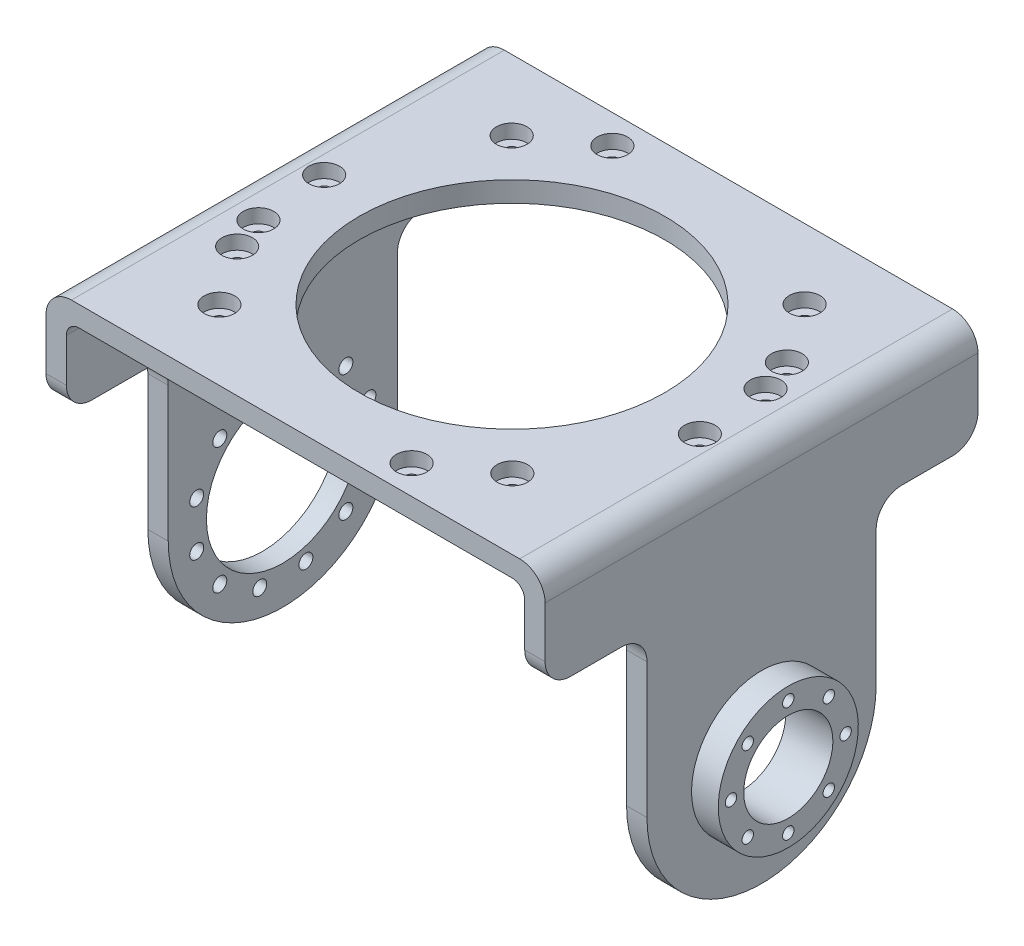
from build123d import *

# Parameters (mm, degrees)
EXTRUDE_1_DEPTH          = 170
SKETCH_2_R               = 60
CUT_EXTRUDE_1_DEPTH      = 180
CUT_EXTRUDE_2_DEPTH      = 313.955268369
CUT_EXTRUDE_2_DEPTH_BACK = 313.955268369
SKETCH_3_R               = 17.5
FILLET_1_R               = 70
FILLET_2_R               = 5
FILLET_3_R               = 10
SKETCH_6_R               = 30
CUT_EXTRUDE_6_DEPTH      = 39
SKETCH_10_R              = 2.5
CUT_EXTRUDE_10_DEPTH     = 10
CUT_EXTRUDE_START        = -5.5
SKETCH_11_R              = 6
SKETCH_11_R_2            = 2.5
CUT_EXTRUDE_11_DEPTH     = 5.5
SKETCH_12_R              = 2.75
CUT_EXTRUDE_12_DEPTH     = 10
EXTRUDE_START            = 10.5
SKETCH_14_R              = 27.5
SKETCH_14_R_2            = 17.5
EXTRUDE_2_DEPTH          = 10.5
SKETCH_13_R              = 2.25
CUT_EXTRUDE_13_DEPTH     = 15
CUT_EXTRUDE_START_2      = -262
CUT_EXTRUDE_14_DEPTH     = 262
FILLET_4_R               = 10


with BuildPart() as part:
    # 草图1 → 凸台-拉伸1 (new body)
    with BuildSketch(Plane.XY):
        Polygon((-180, 0), (0, 0), (0, -175), (8, -175), (8, 8), (-180, 8), (-188, 8), (-188, -175), (-180, -175), align=None)
    extrude(amount=EXTRUDE_1_DEPTH)

    # 草图2 → 切除-拉伸1 (cut)
    with BuildSketch(Plane(origin=(0, 8, 0), x_dir=(1, 0, 0), z_dir=(0, 1, 0))):
        with Locations(Location((-90, -85, 0), (0, 0, 180))):
            Circle(SKETCH_2_R)
    extrude(amount=-CUT_EXTRUDE_1_DEPTH, mode=Mode.SUBTRACT)

    # 草图3 → 切除-拉伸2 (cut, two sides: drawn at the far end of the back side and taken through both)
    with BuildSketch(Plane(origin=(8, 0, 0), x_dir=(0, 0, -1), z_dir=(1, 0, 0)).offset(-CUT_EXTRUDE_2_DEPTH_BACK)):
        with Locations(Location((-85, -95, 0), (0, 0, 90))):
            Circle(SKETCH_3_R)
    extrude(amount=CUT_EXTRUDE_2_DEPTH + CUT_EXTRUDE_2_DEPTH_BACK, mode=Mode.SUBTRACT)

    # 圆角1
    fillet_1_edges = [part.edges().sort_by_distance(p)[0] for p in [
        (4, -175, 0),
        (4, -175, 170),
        (-184, -175, 170),
        (-184, -175, 0),
    ]]
    fillet(fillet_1_edges, radius=FILLET_1_R)

    # 圆角2
    fillet_2_edges = [part.edges().sort_by_distance(p)[0] for p in [
        (0, 0, 85),
        (-180, 0, 85),
    ]]
    fillet(fillet_2_edges, radius=FILLET_2_R)

    # 圆角3
    fillet_3_edges = [part.edges().sort_by_distance(p)[0] for p in [
        (-188, 8, 85),
        (8, 8, 85),
    ]]
    fillet(fillet_3_edges, radius=FILLET_3_R)

    # 草图6 → 切除-拉伸6 (cut)
    with BuildSketch(Plane.ZY.offset(188)):
        with Locations(Location((85, -95, 0), (0, 0, 270))):
            Circle(SKETCH_6_R)
    extrude(amount=-CUT_EXTRUDE_6_DEPTH, mode=Mode.SUBTRACT)

    # 草图10 → 切除-拉伸10 (cut)
    with BuildSketch(Plane.XZ):
        with Locations(Location((-55.742253069, 158.674753309, 0), (0, 0, 270))):
            Circle(SKETCH_10_R)
        with Locations(Location((-32.485217492, 142.390001682, 0), (0, 0, 270))):
            Circle(SKETCH_10_R)
        with Locations(Location((-9.066918551, 92.169297536, 0), (0, 0, 270))):
            Circle(SKETCH_10_R)
        with Locations(Location((-11.541409366, 63.885738097, 0), (0, 0, 270))):
            Circle(SKETCH_10_R)
        with Locations(Location((-16.325246691, 50.742253069, 0), (0, 0, 270))):
            Circle(SKETCH_10_R)
        with Locations(Location((-32.609998318, 27.485217492, 0), (0, 0, 270))):
            Circle(SKETCH_10_R)
        with Locations(Location((-124.257746931, 11.325246691, 0), (0, 0, 270))):
            Circle(SKETCH_10_R)
        with Locations(Location((-147.514782508, 27.609998318, 0), (0, 0, 270))):
            Circle(SKETCH_10_R)
        with Locations(Location((-170.933081449, 77.830702464, 0), (0, 0, 270))):
            Circle(SKETCH_10_R)
        with Locations(Location((-168.458590634, 106.114261903, 0), (0, 0, 270))):
            Circle(SKETCH_10_R)
        with Locations(Location((-163.674753309, 119.257746931, 0), (0, 0, 270))):
            Circle(SKETCH_10_R)
        with Locations(Location((-147.390001682, 142.514782508, 0), (0, 0, 270))):
            Circle(SKETCH_10_R)
    extrude(amount=-CUT_EXTRUDE_10_DEPTH, mode=Mode.SUBTRACT)

    # 草图11 → 切除-拉伸11 (cut)
    # profile 1 of 12: a face of its own
    with BuildSketch(Plane(origin=(0, 8, 0), x_dir=(1, 0, 0), z_dir=(0, 1, 0)).offset(CUT_EXTRUDE_START)):
        with Locations(Location((-32.485217492, -142.390001682, 0), (0, 0, 180))):
            Circle(SKETCH_11_R)
        with Locations(Location((-32.485217492, -142.390001682, 0), (0, 0, 90))):
            Circle(SKETCH_11_R_2, mode=Mode.SUBTRACT)
    # profile 2 of 12: a face of its own
    with BuildSketch(Plane(origin=(0, 8, 0), x_dir=(1, 0, 0), z_dir=(0, 1, 0)).offset(CUT_EXTRUDE_START)):
        with Locations(Location((-55.742253069, -158.674753309, 0), (0, 0, 180))):
            Circle(SKETCH_11_R)
        with Locations(Location((-55.742253069, -158.674753309, 0), (0, 0, 90))):
            Circle(SKETCH_11_R_2, mode=Mode.SUBTRACT)
    # profile 3 of 12: a face of its own
    with BuildSketch(Plane(origin=(0, 8, 0), x_dir=(1, 0, 0), z_dir=(0, 1, 0)).offset(CUT_EXTRUDE_START)):
        with Locations(Location((-147.390001682, -142.514782508, 0), (0, 0, 180))):
            Circle(SKETCH_11_R)
        with Locations(Location((-147.390001682, -142.514782508, 0), (0, 0, 90))):
            Circle(SKETCH_11_R_2, mode=Mode.SUBTRACT)
    # profile 4 of 12: a face of its own
    with BuildSketch(Plane(origin=(0, 8, 0), x_dir=(1, 0, 0), z_dir=(0, 1, 0)).offset(CUT_EXTRUDE_START)):
        with Locations(Location((-163.674753309, -119.257746931, 0), (0, 0, 180))):
            Circle(SKETCH_11_R)
        with Locations(Location((-163.674753309, -119.257746931, 0), (0, 0, 90))):
            Circle(SKETCH_11_R_2, mode=Mode.SUBTRACT)
    # profile 5 of 12: a face of its own
    with BuildSketch(Plane(origin=(0, 8, 0), x_dir=(1, 0, 0), z_dir=(0, 1, 0)).offset(CUT_EXTRUDE_START)):
        with Locations(Location((-168.458590634, -106.114261903, 0), (0, 0, 180))):
            Circle(SKETCH_11_R)
        with Locations(Location((-168.458590634, -106.114261903, 0), (0, 0, 90))):
            Circle(SKETCH_11_R_2, mode=Mode.SUBTRACT)
    # profile 6 of 12: a face of its own
    with BuildSketch(Plane(origin=(0, 8, 0), x_dir=(1, 0, 0), z_dir=(0, 1, 0)).offset(CUT_EXTRUDE_START)):
        with Locations(Location((-170.933081449, -77.830702464, 0), (0, 0, 180))):
            Circle(SKETCH_11_R)
        with Locations(Location((-170.933081449, -77.830702464, 0), (0, 0, 90))):
            Circle(SKETCH_11_R_2, mode=Mode.SUBTRACT)
    # profile 7 of 12: a face of its own
    with BuildSketch(Plane(origin=(0, 8, 0), x_dir=(1, 0, 0), z_dir=(0, 1, 0)).offset(CUT_EXTRUDE_START)):
        with Locations(Location((-147.514782508, -27.609998318, 0), (0, 0, 180))):
            Circle(SKETCH_11_R)
        with Locations(Location((-147.514782508, -27.609998318, 0), (0, 0, 90))):
            Circle(SKETCH_11_R_2, mode=Mode.SUBTRACT)
    # profile 8 of 12: a face of its own
    with BuildSketch(Plane(origin=(0, 8, 0), x_dir=(1, 0, 0), z_dir=(0, 1, 0)).offset(CUT_EXTRUDE_START)):
        with Locations(Location((-124.257746931, -11.325246691, 0), (0, 0, 180))):
            Circle(SKETCH_11_R)
        with Locations(Location((-124.257746931, -11.325246691, 0), (0, 0, 90))):
            Circle(SKETCH_11_R_2, mode=Mode.SUBTRACT)
    # profile 9 of 12: a face of its own
    with BuildSketch(Plane(origin=(0, 8, 0), x_dir=(1, 0, 0), z_dir=(0, 1, 0)).offset(CUT_EXTRUDE_START)):
        with Locations(Location((-32.609998318, -27.485217492, 0), (0, 0, 180))):
            Circle(SKETCH_11_R)
        with Locations(Location((-32.609998318, -27.485217492, 0), (0, 0, 90))):
            Circle(SKETCH_11_R_2, mode=Mode.SUBTRACT)
    # profile 10 of 12: a face of its own
    with BuildSketch(Plane(origin=(0, 8, 0), x_dir=(1, 0, 0), z_dir=(0, 1, 0)).offset(CUT_EXTRUDE_START)):
        with Locations(Location((-16.325246691, -50.742253069, 0), (0, 0, 180))):
            Circle(SKETCH_11_R)
        with Locations(Location((-16.325246691, -50.742253069, 0), (0, 0, 90))):
            Circle(SKETCH_11_R_2, mode=Mode.SUBTRACT)
    # profile 11 of 12: a face of its own
    with BuildSketch(Plane(origin=(0, 8, 0), x_dir=(1, 0, 0), z_dir=(0, 1, 0)).offset(CUT_EXTRUDE_START)):
        with Locations(Location((-11.541409366, -63.885738097, 0), (0, 0, 180))):
            Circle(SKETCH_11_R)
        with Locations(Location((-11.541409366, -63.885738097, 0), (0, 0, 90))):
            Circle(SKETCH_11_R_2, mode=Mode.SUBTRACT)
    # profile 12 of 12: a face of its own
    with BuildSketch(Plane(origin=(0, 8, 0), x_dir=(1, 0, 0), z_dir=(0, 1, 0)).offset(CUT_EXTRUDE_START)):
        with Locations(Location((-9.066918551, -92.169297536, 0), (0, 0, 180))):
            Circle(SKETCH_11_R)
        with Locations(Location((-9.066918551, -92.169297536, 0), (0, 0, 90))):
            Circle(SKETCH_11_R_2, mode=Mode.SUBTRACT)
    extrude(amount=CUT_EXTRUDE_11_DEPTH, mode=Mode.SUBTRACT)

    # 草图12 → 切除-拉伸12 (cut)
    with BuildSketch(Plane.ZY.offset(188)):
        with Locations(Location((94.058666579, -128.80740392, 0), (0, 0, 270))):
            Circle(SKETCH_12_R)
        with Locations(Location((75.941333421, -128.80740392, 0), (0, 0, 270))):
            Circle(SKETCH_12_R)
        with Locations(Location((60.251262658, -119.748737342, 0), (0, 0, 270))):
            Circle(SKETCH_12_R)
        with Locations(Location((51.19259608, -104.058666579, 0), (0, 0, 270))):
            Circle(SKETCH_12_R)
        with Locations(Location((51.19259608, -85.941333421, 0), (0, 0, 270))):
            Circle(SKETCH_12_R)
        with Locations(Location((60.251262658, -70.251262658, 0), (0, 0, 270))):
            Circle(SKETCH_12_R)
        with Locations(Location((75.941333421, -61.19259608, 0), (0, 0, 270))):
            Circle(SKETCH_12_R)
        with Locations(Location((94.058666579, -61.19259608, 0), (0, 0, 270))):
            Circle(SKETCH_12_R)
        with Locations(Location((109.748737342, -70.251262658, 0), (0, 0, 270))):
            Circle(SKETCH_12_R)
        with Locations(Location((118.80740392, -85.941333421, 0), (0, 0, 270))):
            Circle(SKETCH_12_R)
        with Locations(Location((118.80740392, -104.058666579, 0), (0, 0, 270))):
            Circle(SKETCH_12_R)
        with Locations(Location((109.748737342, -119.748737342, 0), (0, 0, 270))):
            Circle(SKETCH_12_R)
    extrude(amount=-CUT_EXTRUDE_12_DEPTH, mode=Mode.SUBTRACT)

    # 草图14 → 凸台-拉伸2 (add)
    with BuildSketch(Plane(origin=(8, 0, 0), x_dir=(0, 0, -1), z_dir=(1, 0, 0)).offset(EXTRUDE_START)):
        with Locations(Location((-85, -95, 0), (0, 0, 270))):
            Circle(SKETCH_14_R)
        with Locations(Location((-85, -95, 0), (0, 0, 90))):
            Circle(SKETCH_14_R_2, mode=Mode.SUBTRACT)
    extrude(amount=-EXTRUDE_2_DEPTH)

    # 草图13 → 切除-拉伸13 (cut, symmetric)
    with BuildSketch(Plane(origin=(8, 0, 0), x_dir=(0, 0, -1), z_dir=(1, 0, 0))):
        with Locations(Location((-85, -72.5, 0), (0, 0, 90))):
            Circle(SKETCH_13_R)
        with Locations(Location((-69.090097423, -79.090097423, 0), (0, 0, 90))):
            Circle(SKETCH_13_R)
        with Locations(Location((-62.5, -95, 0), (0, 0, 90))):
            Circle(SKETCH_13_R)
        with Locations(Location((-69.090097423, -110.909902577, 0), (0, 0, 90))):
            Circle(SKETCH_13_R)
        with Locations(Location((-85, -117.5, 0), (0, 0, 90))):
            Circle(SKETCH_13_R)
        with Locations(Location((-100.909902577, -110.909902577, 0), (0, 0, 90))):
            Circle(SKETCH_13_R)
        with Locations(Location((-107.5, -95, 0), (0, 0, 90))):
            Circle(SKETCH_13_R)
        with Locations(Location((-100.909902577, -79.090097423, 0), (0, 0, 90))):
            Circle(SKETCH_13_R)
    extrude(amount=CUT_EXTRUDE_13_DEPTH, both=True, mode=Mode.SUBTRACT)

    # 草图15 → 切除-拉伸14 (cut)
    with BuildSketch(Plane.ZY.offset(188).offset(CUT_EXTRUDE_START_2)):
        with BuildLine():
            Line((0, -32), (40, -32))
            Line((40, -32), (40, -95))
            ThreePointArc((40, -95), (85, -140), (130, -95))
            Line((130, -95), (130, -32))
            Line((130, -32), (170, -32))
            Line((170, -32), (170, -105))
            ThreePointArc((170, -105), (149.497474683, -154.497474683), (100, -175))
            Line((100, -175), (70, -175))
            ThreePointArc((70, -175), (20.502525317, -154.497474683), (0, -105))
            Line((0, -105), (0, -32))
        make_face()
    extrude(amount=CUT_EXTRUDE_14_DEPTH, mode=Mode.SUBTRACT)

    # 圆角4
    fillet_4_edges = [part.edges().sort_by_distance(p)[0] for p in [
        (4, -32, 40),
        (-184, -32, 40),
        (4, -32, 130),
        (-184, -32, 130),
        (4, -32, 0),
        (-184, -32, 0),
        (4, -32, 170),
        (-184, -32, 170),
    ]]
    fillet(fillet_4_edges, radius=FILLET_4_R)


solid = part.part
